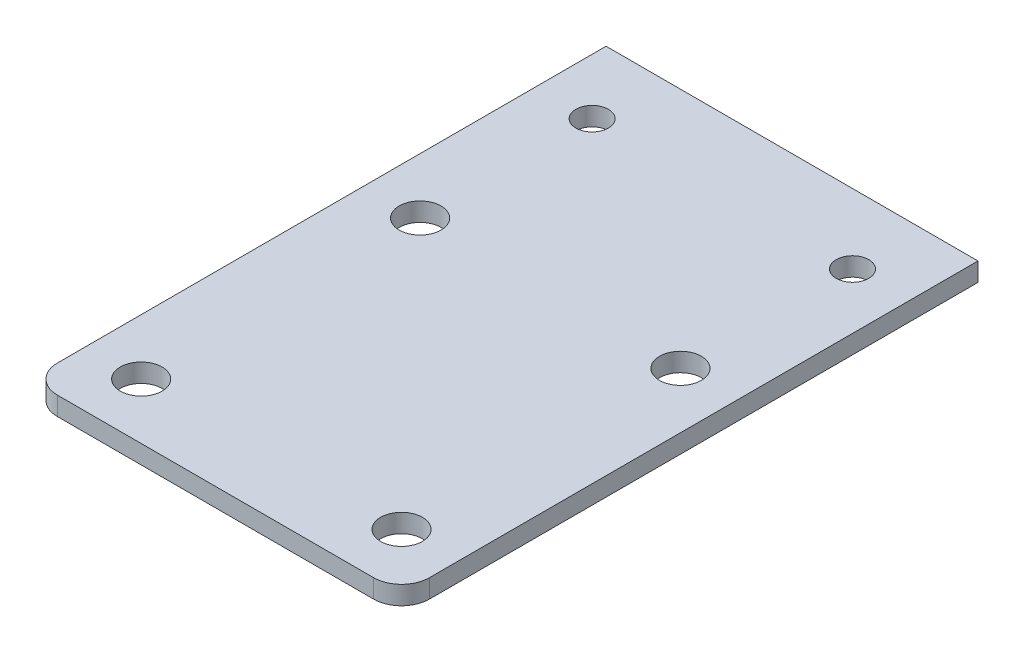
from build123d import *

# Parameters (mm, degrees)
EXTRUDE_1_DEPTH = 2


with BuildPart() as part:
    # 草图1 → 凸台-拉伸1 (new body)
    with BuildSketch(Plane(origin=(0, 0, 0), x_dir=(1, 0, 0), z_dir=(0, 1, 0))):
        with BuildLine():
            Line((-11.75, 0), (0, 0))
            Line((0, 0), (0, 30))
            Line((0, 30), (-11.75, 30))
            ThreePointArc((-11.75, 30), (-12.409009742, 28.409009742), (-14, 27.75))
            Line((-14, 27.75), (-14, 2.25))
            ThreePointArc((-14, 2.25), (-12.409009742, 1.590990258), (-11.75, 0))
        make_face()
        with BuildLine():
            Line((0, 30), (0, 0))
            Line((0, 0), (11.75, 0))
            ThreePointArc((11.75, 0), (12.409009742, 1.590990258), (14, 2.25))
            Line((14, 2.25), (14, 27.75))
            ThreePointArc((14, 27.75), (12.409009742, 28.409009742), (11.75, 30))
            Line((11.75, 30), (0, 30))
        make_face()
        with BuildLine():
            Line((11.75, 0), (0, 0))
            Line((0, 0), (-11.75, 0))
            ThreePointArc((-11.75, 0), (-15.590990258, -1.590990258), (-14, 2.25))
            Line((-14, 2.25), (-14, 27.75))
            ThreePointArc((-14, 27.75), (-16.25, 30), (-14, 32.25))
            Line((-14, 32.25), (-14, 46.75))
            ThreePointArc((-14, 46.75), (-15.75, 48.5), (-14, 50.25))
            Line((-14, 50.25), (-14, 56))
            Line((-14, 56), (-20, 56))
            Line((-20, 56), (-20, -3))
            ThreePointArc((-20, -3), (-19.121320344, -5.121320344), (-17, -6))
            Line((-17, -6), (17, -6))
            ThreePointArc((17, -6), (19.121320344, -5.121320344), (20, -3))
            Line((20, -3), (20, 56))
            Line((20, 56), (14, 56))
            Line((14, 56), (14, 50.25))
            ThreePointArc((14, 50.25), (15.237436867, 49.737436867), (15.75, 48.5))
            ThreePointArc((15.75, 48.5), (15.237436867, 47.262563133), (14, 46.75))
            Line((14, 46.75), (14, 32.25))
            ThreePointArc((14, 32.25), (15.590990258, 31.590990258), (16.25, 30))
            ThreePointArc((16.25, 30), (15.590990258, 28.409009742), (14, 27.75))
            Line((14, 27.75), (14, 2.25))
            ThreePointArc((14, 2.25), (15.590990258, 1.590990258), (16.25, 0))
            ThreePointArc((16.25, 0), (14, -2.25), (11.75, 0))
        make_face()
        with BuildLine():
            Line((-11.75, 30), (0, 30))
            Line((0, 30), (11.75, 30))
            ThreePointArc((11.75, 30), (12.409009742, 31.590990258), (14, 32.25))
            Line((14, 32.25), (14, 46.75))
            ThreePointArc((14, 46.75), (12.25, 48.5), (14, 50.25))
            Line((14, 50.25), (14, 56))
            Line((14, 56), (-14, 56))
            Line((-14, 56), (-14, 50.25))
            ThreePointArc((-14, 50.25), (-12.762563133, 49.737436867), (-12.25, 48.5))
            ThreePointArc((-12.25, 48.5), (-12.762563133, 47.262563133), (-14, 46.75))
            Line((-14, 46.75), (-14, 32.25))
            ThreePointArc((-14, 32.25), (-12.409009742, 31.590990258), (-11.75, 30))
        make_face()
    extrude(amount=EXTRUDE_1_DEPTH)


solid = part.part
